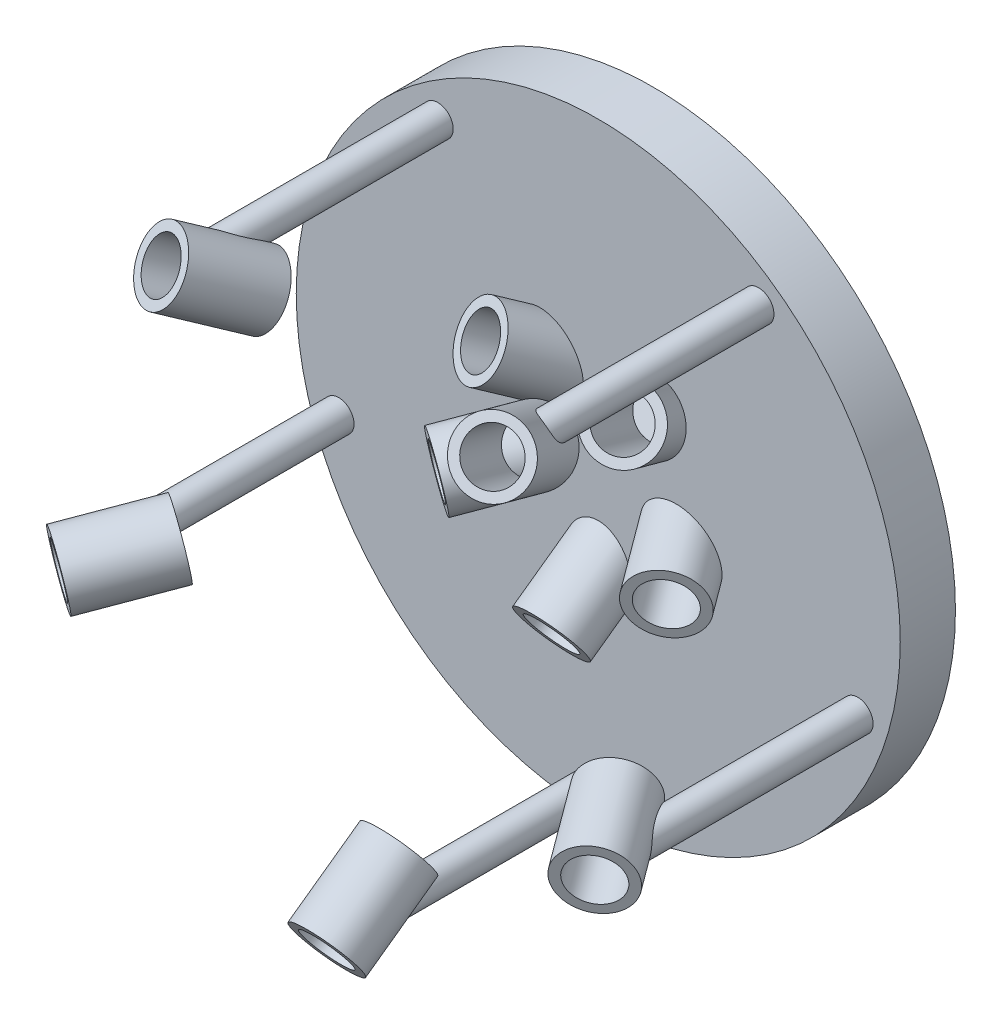
from build123d import *

# Parameters (mm, degrees)
SKETCH1_R            = 98.5
BOSS_EXTRUDE1_DEPTH  = 9
SWEEP2_PROFILE_R     = 11
SKETCH65_R           = 5
BOSS_EXTRUDE2_DEPTH  = 96
CUT_SWEEP1_PROFILE_R = 8
CUT_SWEEP8_PROFILE_R = 11
CUT_SWEEP7_PROFILE_R = 2.5
CIRPATTERN1_COUNT    = 5


with BuildPart() as part:
    # Sketch1 → Boss-Extrude1 (new, symmetric)
    with BuildSketch(Plane.XY):
        Circle(SKETCH1_R)
    extrude(amount=BOSS_EXTRUDE1_DEPTH, both=True)

    # Sweep2: sweep along a path in Sketch3
    with BuildLine(Plane(origin=(0, 0, 0), x_dir=(0, 0, -1), z_dir=(1, 0, 0))) as sweep2_path:
        Line((0, -22), (-97.537036334, -91.903694775))
    # Sweep2 profile (on start of the path) → Sweep2 (sweep)
    with BuildSketch(Plane(origin=(0, -22, 0), x_dir=(0, 0.8128086361148117, 0.5825307897932775), z_dir=(0, -0.5825307897932775, 0.8128086361148117))):
        Circle(SWEEP2_PROFILE_R)
    sweep2 = sweep(path=sweep2_path.line)

    # Sketch65 → Boss-Extrude2 (add)
    with BuildSketch(Plane.XY):
        with Locations((0, -89)):
            Circle(SKETCH65_R)
    boss_extrude2 = extrude(amount=BOSS_EXTRUDE2_DEPTH)

    # Cut-Sweep1: sweep along a path in Sketch3<2>
    with BuildLine(Plane(origin=(0, 0, 0), x_dir=(0, 0, -1), z_dir=(1, 0, 0))) as cut_sweep1_path:
        Line((0, -22), (-97.537036334, -91.903694775))
    # Cut-Sweep1 profile (on start of the path) → Cut-Sweep1 (sweep, cut)
    with BuildSketch(Plane(origin=(0, -22, 0), x_dir=(0, 0.8128086361148117, 0.5825307897932775), z_dir=(0, -0.5825307897932775, 0.8128086361148117))):
        Circle(CUT_SWEEP1_PROFILE_R)
    cut_sweep1 = sweep(path=cut_sweep1_path.line, mode=Mode.SUBTRACT)

    # Cut-Sweep8: sweep along a path in Sketch534
    with BuildLine(Plane(origin=(0, 0, 0), x_dir=(0, 0, -1), z_dir=(1, 0, 0))) as cut_sweep8_path:
        Line((-24.237328538, -39.370620228), (-74.016413707, -75.046729597))
    # Cut-Sweep8 profile (on start of the path) → Cut-Sweep8 (sweep, cut)
    with BuildSketch(Plane(origin=(0, -39.370620228, 24.237328538), x_dir=(0, 0.8128086361148117, 0.5825307897932777), z_dir=(0, -0.5825307897932777, 0.8128086361148117))):
        Circle(CUT_SWEEP8_PROFILE_R)
    cut_sweep8 = sweep(path=cut_sweep8_path.line, mode=Mode.SUBTRACT)

    # Cut-Sweep7: sweep along a path in Sketch199
    with BuildLine(Plane(origin=(0, 0, 0), x_dir=(0, 0, -1), z_dir=(1, 0, 0))) as cut_sweep7_path:
        Line((5.317627658, -21.308382404), (-9, -28.450198577))
    # Cut-Sweep7 profile (on start of the path) → Cut-Sweep7 (sweep, cut)
    with BuildSketch(Plane(origin=(0, -21.308382404, -5.317627658), x_dir=(0, 0.89485172861867, 0.44636351081621606), z_dir=(0, -0.44636351081621606, 0.89485172861867))):
        Circle(CUT_SWEEP7_PROFILE_R)
    cut_sweep7 = sweep(path=cut_sweep7_path.line, mode=Mode.SUBTRACT)

    # CirPattern1: Sweep2, Boss-Extrude2, Cut-Sweep1, Cut-Sweep8, Cut-Sweep7 ×5 about axis
    cirpattern1_axis = Axis((0, 0, 0), (0, 0, 1))
    add([sweep2.rotate(cirpattern1_axis, i * 360 / CIRPATTERN1_COUNT) for i in range(1, CIRPATTERN1_COUNT)])
    add([boss_extrude2.rotate(cirpattern1_axis, i * 360 / CIRPATTERN1_COUNT) for i in range(1, CIRPATTERN1_COUNT)])
    add([cut_sweep1.rotate(cirpattern1_axis, i * 360 / CIRPATTERN1_COUNT) for i in range(1, CIRPATTERN1_COUNT)], mode=Mode.SUBTRACT)
    add([cut_sweep8.rotate(cirpattern1_axis, i * 360 / CIRPATTERN1_COUNT) for i in range(1, CIRPATTERN1_COUNT)], mode=Mode.SUBTRACT)
    add([cut_sweep7.rotate(cirpattern1_axis, i * 360 / CIRPATTERN1_COUNT) for i in range(1, CIRPATTERN1_COUNT)], mode=Mode.SUBTRACT)


solid = part.part
